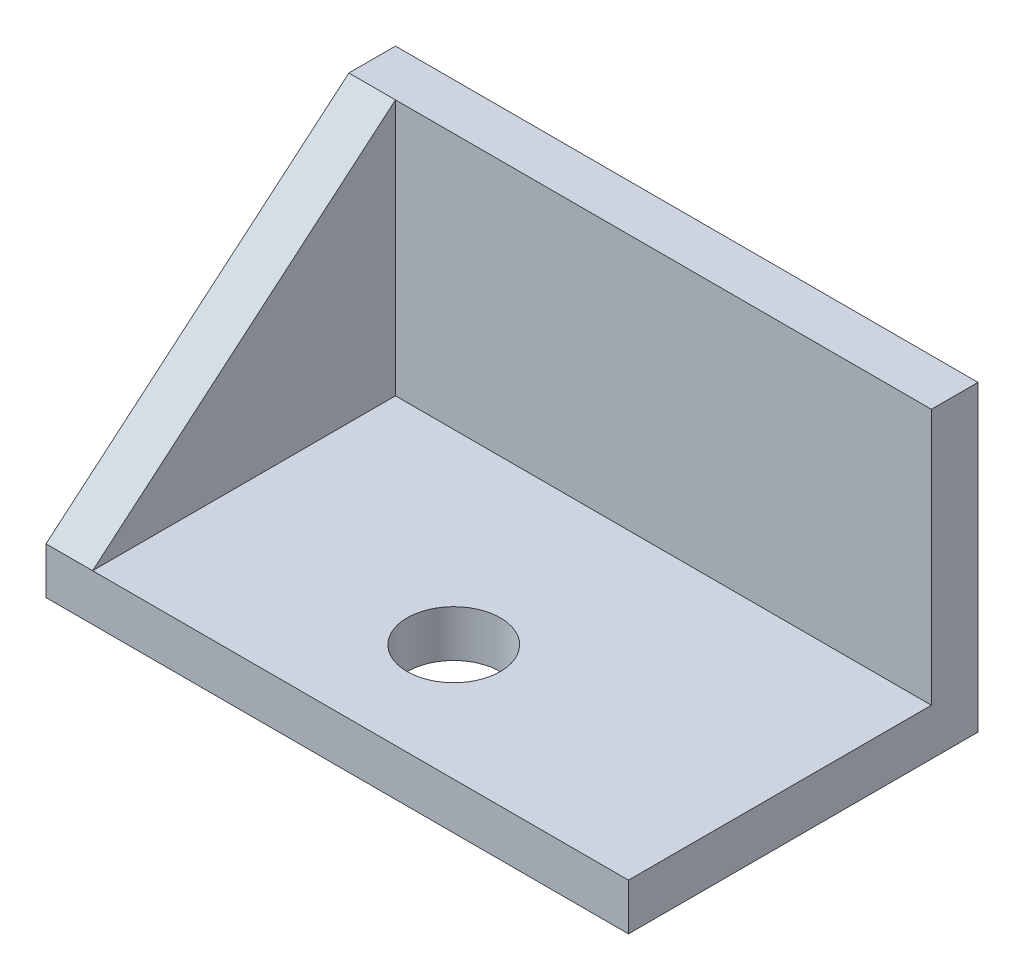
from build123d import *

# Parameters (mm, degrees)
BOSS_EXTRUDE2_DEPTH = 10
SKETCH2_W           = 10
SKETCH2_H           = 55
BOSS_EXTRUDE3_DEPTH = 125
BOSS_EXTRUDE4_DEPTH = 10


with BuildPart() as part:
    # Sketch1 → Boss-Extrude2 (new body)
    with BuildSketch(Plane(origin=(0, 0, 0), x_dir=(1, 0, 0), z_dir=(0, 1, 0))):
        Polygon((125, 0), (0, 0), (0, -75), (62.5, -75), (125, -75), align=None)
        with BuildLine():
            ThreePointArc((72.5, -50), (69.571067812, -57.071067812), (62.5, -60))
            ThreePointArc((62.5, -60), (55.428932188, -42.928932188), (72.5, -50))
        make_face(mode=Mode.SUBTRACT)
    extrude(amount=BOSS_EXTRUDE2_DEPTH)

    # Sketch2 → Boss-Extrude3 (add)
    with BuildSketch(Plane.ZY):
        with Locations((5, 37.5)):
            Rectangle(SKETCH2_W, SKETCH2_H)
    extrude(amount=-BOSS_EXTRUDE3_DEPTH)

    # Sketch2<3> → Boss-Extrude4 (add)
    with BuildSketch(Plane.ZY):
        Polygon((10, 65), (10, 10), (75, 10), align=None)
    extrude(amount=-BOSS_EXTRUDE4_DEPTH)


solid = part.part
